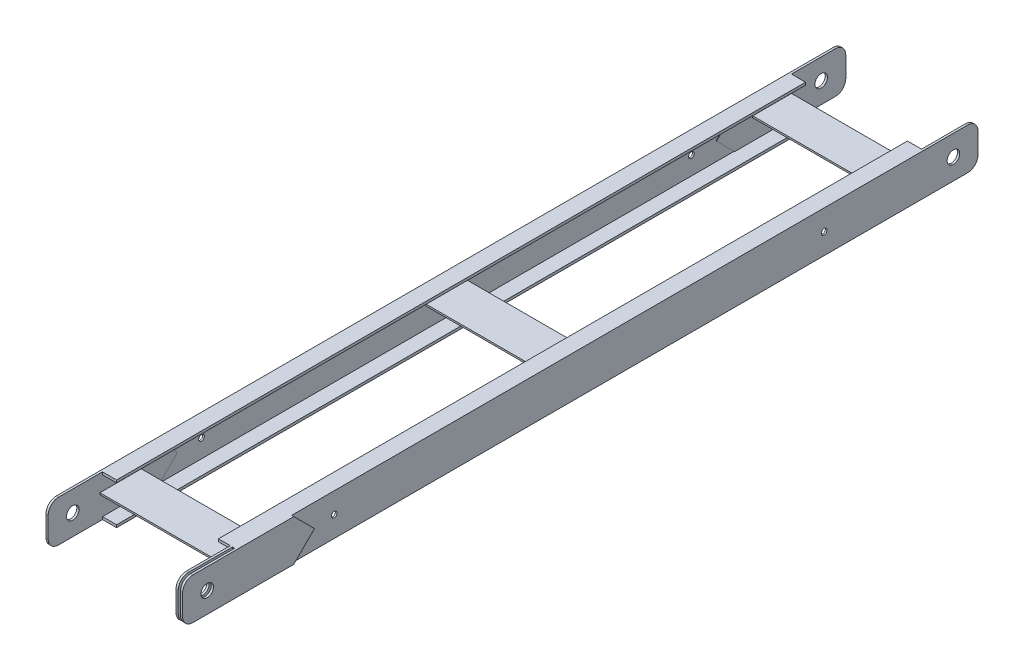
from build123d import *

# Parameters (mm, degrees)
EXTRUDE_1_DEPTH        = 3085
EXTRUDE_1_2_DEPTH      = 3085
EXTRUDE_3_DEPTH        = 520
SKETCH_6_W             = 503
SKETCH_6_H             = 210
CUT_EXTRUDE_4_DEPTH    = 3133.606741996
PATTERN_LINEAR_1_COUNT = 3
PATTERN_LINEAR_1_PITCH = 1262.5
SKETCH_7_W             = 500
SKETCH_7_H             = 140
EXTRUDE_5_DEPTH        = 2
CUT_EXTRUDE_6_DEPTH    = 2
CUT_EXTRUDE_7_DEPTH    = 2
SKETCH_15_W            = 500
SKETCH_15_H            = 140
EXTRUDE_8_DEPTH        = 2
CUT_EXTRUDE_9_DEPTH    = 2
CUT_EXTRUDE_10_DEPTH   = 2
EXTRUDE_11_DEPTH       = 8.5
PATTERN_LINEAR_2_COUNT = 2
PATTERN_LINEAR_2_PITCH = 17
SKETCH_22_W            = 8.5
SKETCH_22_H            = 210
CUT_EXTRUDE_12_DEPTH   = 3135.028916586
FILLET_1_R             = 40
SKETCH_23_R            = 24.25
CUT_EXTRUDE_13_DEPTH   = 3135.028916586
SKETCH_24_R            = 11
CUT_EXTRUDE_14_DEPTH   = 3133.606741996


with BuildPart() as part:
    # 草图2 → 拉伸1 (new body)
    with BuildSketch(Plane.XY):
        Polygon((0, 0), (0, 160), (63, 160), (63, 150), (6.5, 150), (6.5, 10), (63, 10), (63, 0), align=None)
    extrude(amount=EXTRUDE_1_DEPTH)



with BuildPart() as body_2:
    # 草图2 → Extrude 1 2 (new body)
    with BuildSketch(Plane.XY):
        Polygon((457, 160), (520, 160), (520, 0), (457, 0), (457, 10), (513.5, 10), (513.5, 150), (457, 150), align=None)
    extrude(amount=EXTRUDE_1_2_DEPTH)


with BuildPart() as part_1:
    add(part.part)

    add(body_2.part)  # 拉伸3 merges body 2
    # 草图5 → 拉伸3 (add)
    with BuildSketch(Plane.ZY):
        Polygon((200, 95), (360, 95), (360, 88.5), (283.25, 88.5), (283.25, 48.5), (276.75, 48.5), (276.75, 88.5), (200, 88.5), align=None)
    extrude_3 = extrude(amount=-EXTRUDE_3_DEPTH)

    # 草图6 → 拉伸4 (cut, through all)
    with BuildSketch(Plane(origin=(0, 160, 0), x_dir=(1, 0, 0), z_dir=(0, 1, 0))):
        with Locations((260, -105)):
            Rectangle(SKETCH_6_W, SKETCH_6_H)
        with Locations((260, -2980)):
            Rectangle(SKETCH_6_W, SKETCH_6_H)
    extrude(amount=-CUT_EXTRUDE_4_DEPTH, mode=Mode.SUBTRACT)

    # 阵列(线性)1: 拉伸3 ×3
    with Locations(*[(0, 0, i * PATTERN_LINEAR_1_PITCH) for i in range(1, PATTERN_LINEAR_1_COUNT)]):
        add(extrude_3)

    # 草图7 → 拉伸5 (add)
    with BuildSketch(Plane.ZY.offset(-513.5)):
        with Locations((250, 80)):
            Rectangle(SKETCH_7_W, SKETCH_7_H)
        with Locations((2835, 80)):
            Rectangle(SKETCH_7_W, SKETCH_7_H)
    extrude(amount=EXTRUDE_5_DEPTH)

    # 草图13 → 拉伸6 (cut)
    with BuildSketch(Plane.ZY.offset(-511.5)):
        Polygon((500, 10), (500, 80), (430, 10), align=None)
        Polygon((2585, 150), (2655, 150), (2585, 80), align=None)
    extrude(amount=-CUT_EXTRUDE_6_DEPTH, mode=Mode.SUBTRACT)

    # 草图14 → 拉伸7 (cut)
    with BuildSketch(Plane.ZY.offset(-511.5)):
        Polygon((500, 80), (430, 150), (500, 150), align=None)
        Polygon((2585, 80), (2655, 10), (2585, 10), align=None)
    extrude(amount=-CUT_EXTRUDE_7_DEPTH, mode=Mode.SUBTRACT)

    # 草图15 → 拉伸8 (add)
    with BuildSketch(Plane(origin=(6.5, 0, 0), x_dir=(0, 0, -1), z_dir=(1, 0, 0))):
        with Locations((-2835, 80)):
            Rectangle(SKETCH_15_W, SKETCH_15_H)
        with Locations((-250, 80)):
            Rectangle(SKETCH_15_W, SKETCH_15_H)
    extrude(amount=EXTRUDE_8_DEPTH)

    # 草图16 → 拉伸9 (cut)
    with BuildSketch(Plane(origin=(8.5, 0, 0), x_dir=(0, 0, -1), z_dir=(1, 0, 0))):
        Polygon((-2585, 150), (-2585, 80), (-2655, 150), align=None)
        Polygon((-500, 150), (-500, 80), (-430, 150), align=None)
    extrude(amount=-CUT_EXTRUDE_9_DEPTH, mode=Mode.SUBTRACT)

    # 草图18 → 拉伸10 (cut)
    with BuildSketch(Plane(origin=(8.5, 0, 0), x_dir=(0, 0, -1), z_dir=(1, 0, 0))):
        Polygon((-500, 80), (-500, 10), (-430, 10), align=None)
        Polygon((-2585, 10), (-2655, 10), (-2585, 80), align=None)
    extrude(amount=-CUT_EXTRUDE_10_DEPTH, mode=Mode.SUBTRACT)

    # 草图19 → 拉伸11 (add)
    with BuildSketch(Plane(origin=(520, 0, 0), x_dir=(0, 0, -1), z_dir=(1, 0, 0))):
        Polygon((-3085, 160), (-2655, 160), (-2575, 80), (-2655, 0), (-3085, 0), align=None)
    extrude_11 = extrude(amount=EXTRUDE_11_DEPTH)

    # 阵列(线性)2: 拉伸11 ×2
    with Locations(*[(-i * PATTERN_LINEAR_2_PITCH, 0, 0) for i in range(1, PATTERN_LINEAR_2_COUNT)]):
        add(extrude_11)

    # 草图22 → 拉伸12 (cut, through all)
    with BuildSketch(Plane(origin=(0, 160, 0), x_dir=(1, 0, 0), z_dir=(0, 1, 0))):
        with Locations((515.75, -2980)):
            Rectangle(SKETCH_22_W, SKETCH_22_H)
    extrude(amount=-CUT_EXTRUDE_12_DEPTH, mode=Mode.SUBTRACT)

    # 圆角1
    fillet_1_edges = [part_1.edges().sort_by_distance(p)[0] for p in [
        (4.25, 0, 0),
        (507.25, 0, 3085),
        (4.25, 160, 3085),
        (4.25, 0, 3085),
        (507.25, 160, 3085),
        (524.25, 0, 3085),
        (515.75, 160, 0),
        (524.25, 160, 3085),
        (515.75, 0, 0),
        (4.25, 160, 0),
    ]]
    fillet(fillet_1_edges, radius=FILLET_1_R)

    # 草图23 → 拉伸13 (cut, through all)
    with BuildSketch(Plane.ZY):
        with Locations((95, 80)):
            Circle(SKETCH_23_R)
        with Locations(Location((2990, 80, 0), (0, 0, 180))):
            Circle(SKETCH_23_R)
    extrude(amount=-CUT_EXTRUDE_13_DEPTH, mode=Mode.SUBTRACT)

    # 草图24 → 拉伸14 (cut, through all)
    with BuildSketch(Plane(origin=(520, 0, 0), x_dir=(0, 0, -1), z_dir=(1, 0, 0))):
        with Locations((-2490, 80)):
            Circle(SKETCH_24_R)
        with Locations((-595, 80)):
            Circle(SKETCH_24_R)
    extrude(amount=-CUT_EXTRUDE_14_DEPTH, mode=Mode.SUBTRACT)


solid = part_1.part
